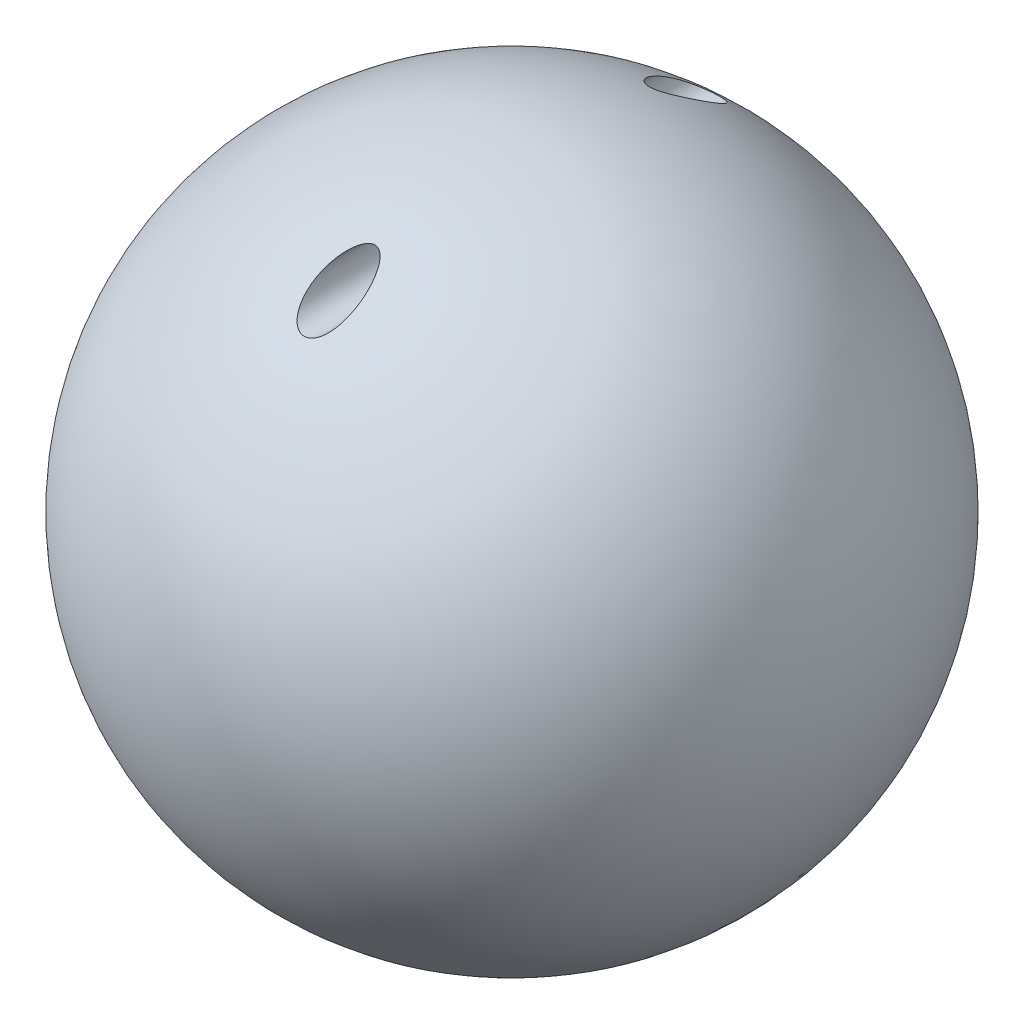
from build123d import *

# Parameters (mm, degrees)
CUT_EXTRUDE5_DEPTH      = 94.3255592
CUT_EXTRUDE5_DEPTH_BACK = 94.3255592
SKETCH5_R               = 2.532766939


with BuildPart() as part:
    # Sketch1 → Revolve1 (revolve)
    with BuildSketch(Plane.XY):
        with BuildLine():
            Line((0, 0), (0, 76.2))
            ThreePointArc((0, 76.2), (38.1, 38.1), (0, 0))
        make_face()
    revolve(axis=Axis((0, 0, 0), (0, 1, 0)))

    # Sketch5 → Cut-Extrude5 (cut, two sides: drawn at the far end of the back side and taken through both)
    with BuildSketch(Plane.XY.offset(-CUT_EXTRUDE5_DEPTH_BACK)):
        with Locations(Location((0, 70.216891875, 0), (0, 0, 247.822134575))):
            Circle(SKETCH5_R)
    extrude(amount=CUT_EXTRUDE5_DEPTH + CUT_EXTRUDE5_DEPTH_BACK, mode=Mode.SUBTRACT)


solid = part.part
